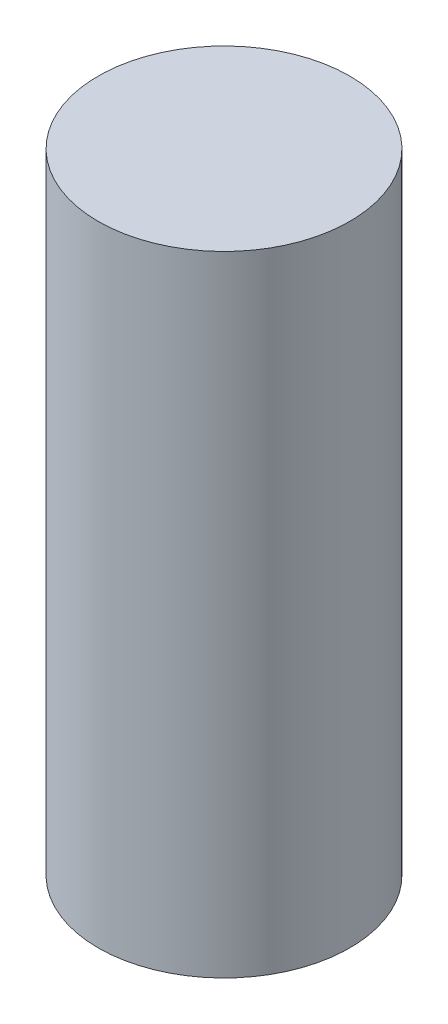
from build123d import *

# Parameters (mm, degrees)
SKETCH1_R           = 609.6
BOSS_EXTRUDE1_DEPTH = 3048


with BuildPart() as part:
    # Sketch1 → Boss-Extrude1 (new body)
    with BuildSketch(Plane(origin=(0, 0, 0), x_dir=(1, 0, 0), z_dir=(0, 1, 0))):
        with Locations(Location((0, 0, 0), (0, 0, 270))):
            Circle(SKETCH1_R)
    extrude(amount=BOSS_EXTRUDE1_DEPTH)


solid = part.part
